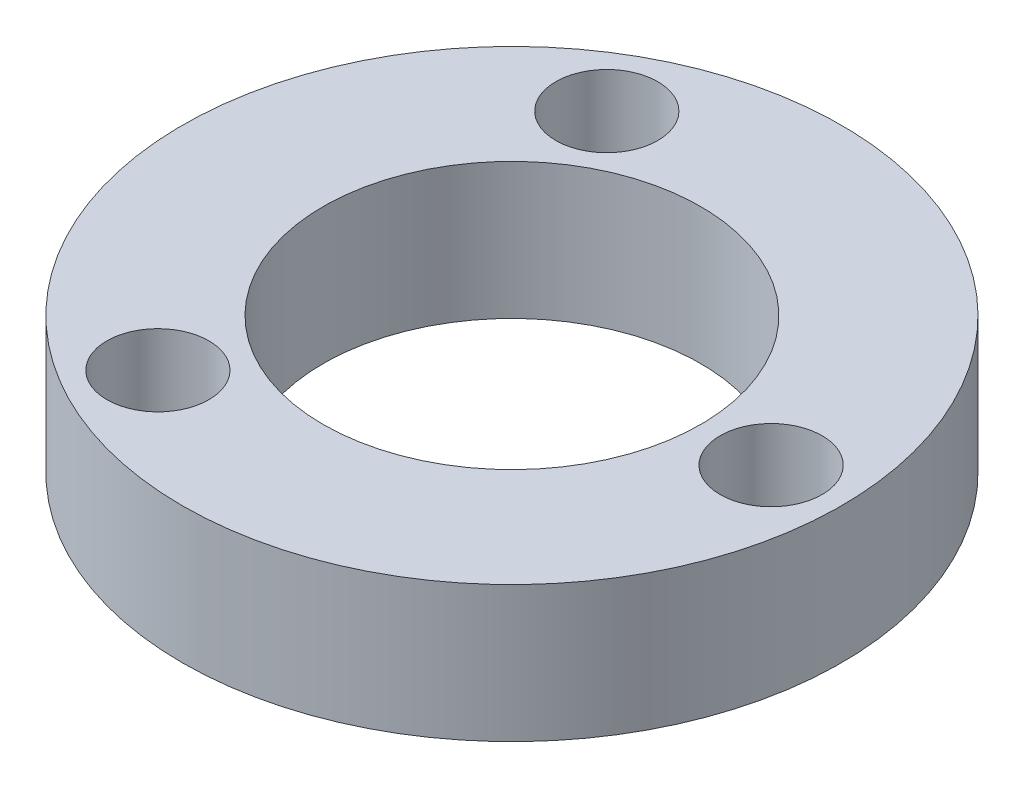
from build123d import *

# Parameters (mm, degrees)
SKETCH1_R           = 24.2275
SKETCH1_R_2         = 13.8775
BOSS_EXTRUDE1_DEPTH = 10
SKETCH3_R           = 3.75
CUT_EXTRUDE1_DEPTH  = 7.5
CIRPATTERN1_COUNT   = 3


with BuildPart() as part:
    # Sketch1 → Boss-Extrude1 (new body)
    with BuildSketch(Plane(origin=(0, 0, 0), x_dir=(1, 0, 0), z_dir=(0, 1, 0))):
        with Locations(Location((0, 0, 0), (0, 0, 270))):
            Circle(SKETCH1_R)
        with Locations(Location((0, 0, 0), (0, 0, 270))):
            Circle(SKETCH1_R_2, mode=Mode.SUBTRACT)
    extrude(amount=BOSS_EXTRUDE1_DEPTH)

    # Sketch3 → Cut-Extrude1 (cut)
    with BuildSketch(Plane(origin=(0, 10, 0), x_dir=(1, 0, 0), z_dir=(0, 1, 0))):
        with Locations(Location((19.0525, 0, 0), (0, 0, 270))):
            Circle(SKETCH3_R)
    cut_extrude1 = extrude(amount=-CUT_EXTRUDE1_DEPTH, mode=Mode.SUBTRACT)

    # CirPattern1: Cut-Extrude1 ×3 about axis
    cirpattern1_axis = Axis((0, 0, 0), (0, 1, 0))
    for i in range(1, CIRPATTERN1_COUNT):
        add(cut_extrude1.rotate(cirpattern1_axis, i * 360 / CIRPATTERN1_COUNT), mode=Mode.SUBTRACT)


solid = part.part
